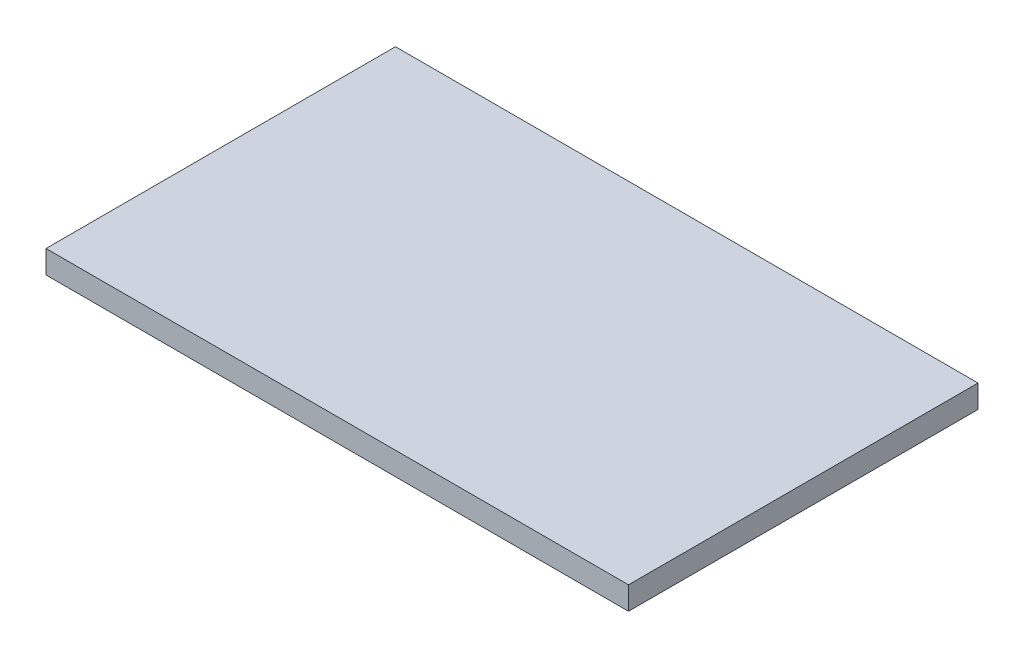
from build123d import *

# Parameters (mm, degrees)
SKETCH1_W           = 508
SKETCH1_H           = 304.8
BOSS_EXTRUDE1_DEPTH = 20


with BuildPart() as part:
    # Sketch1 → Boss-Extrude1 (new body)
    with BuildSketch(Plane(origin=(0, 0, 0), x_dir=(1, 0, 0), z_dir=(0, 1, 0))):
        Rectangle(SKETCH1_W, SKETCH1_H)
    extrude(amount=-BOSS_EXTRUDE1_DEPTH)


solid = part.part
